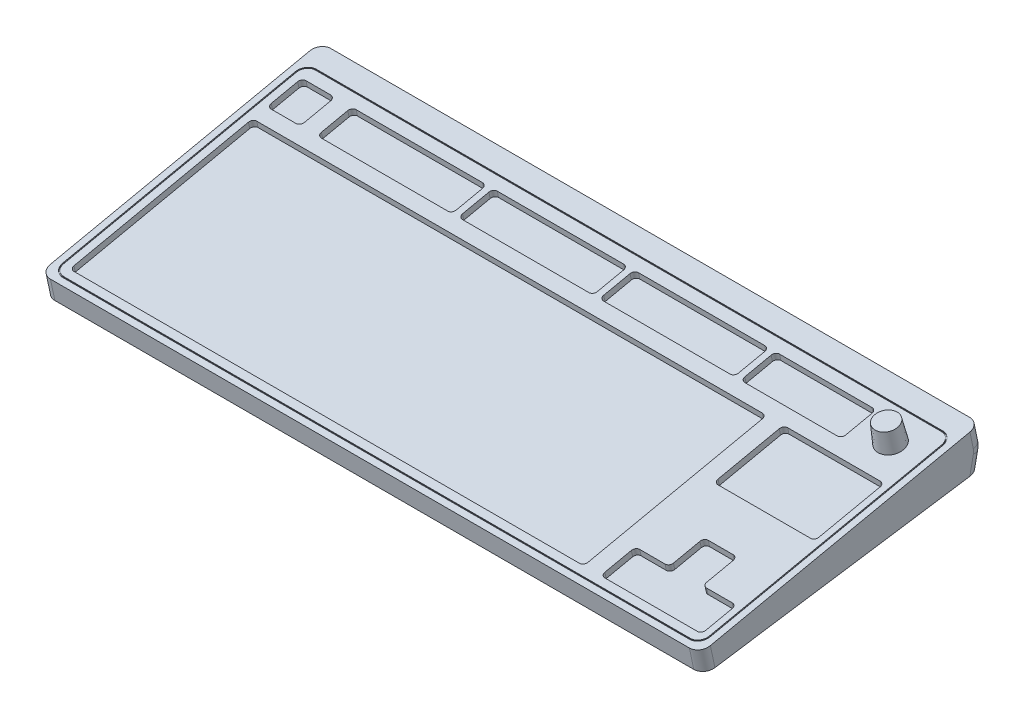
from build123d import *

# Parameters (mm, degrees)
SKETCH2_W               = 311
SKETCH2_H               = 135
BOSS_EXTRUDE1_DEPTH     = 10
BOSS_EXTRUDE2_DEPTH     = 311
FILLET1_R               = 10
FILLET2_R               = 5
CUT_EXTRUDE_THIN1_DEPTH = 0.5
CUT_EXTRUDE1_DEPTH      = 3
SKETCH8_R               = 6
BOSS_EXTRUDE3_DEPTH     = 10
BOSS_EXTRUDE3_TAPER     = 4


with BuildPart() as part:
    # Sketch2 → Boss-Extrude1 (new body)
    with BuildSketch(Plane(origin=(0, 0, 0), x_dir=(1, 0, 0), z_dir=(0, 0.9781476007338056, 0.2079116908177598))):
        with Locations((155.5, 67.5)):
            Rectangle(SKETCH2_W, SKETCH2_H)
    extrude(amount=-BOSS_EXTRUDE1_DEPTH)

    # Sketch5 → Boss-Extrude2 (add)
    with BuildSketch(Plane.ZY):
        Polygon((-134.129043007, 18.286602253), (-132.399185443, 9.762104074), (-2.079116908, -9.781476007), align=None)
    extrude(amount=-BOSS_EXTRUDE2_DEPTH)

    # Fillet1
    fillet1_edges = [part.edges().sort_by_distance(p)[0] for p in [
        (155.5, 18.286602253, -134.129043007),
    ]]
    fillet(fillet1_edges, radius=FILLET1_R)

    # Fillet2
    fillet2_edges = [part.edges().sort_by_distance(p)[0] for p in [
        (311, 24.193330233, -132.873529217),
        (0, 24.193330233, -132.873529217),
        (0, 13.006413151, -133.057545909),
        (0, 18.285616937, -133.915549829),
        (311, 13.006413151, -133.057545909),
        (311, 18.285616937, -133.915549829),
        (311, -4.890738004, -1.039558454),
        (0, -4.890738004, -1.039558454),
    ]]
    fillet(fillet2_edges, radius=FILLET2_R)

    # Sketch6 → Cut-Extrude-Thin1 (cut)
    # profile 1 of 2: a face of its own
    with BuildSketch(Plane(origin=(0, 0, 0), x_dir=(1, 0, 0), z_dir=(0, 0.9781476007338056, 0.20791169081775976))):
        with BuildLine():
            Line((3, 120), (3, 8))
            ThreePointArc((3, 8), (4.464466094, 4.464466094), (8, 3))
            Line((8, 3), (303, 3))
            ThreePointArc((303, 3), (306.535533906, 4.464466094), (308, 8))
            Line((308, 8), (308, 120))
            ThreePointArc((308, 120), (306.535533906, 123.535533906), (303, 125))
            Line((303, 125), (8, 125))
            ThreePointArc((8, 125), (4.464466094, 123.535533906), (3, 120))
        make_face()
        with BuildLine():
            Line((3.5, 120), (3.5, 8))
            ThreePointArc((3.5, 8), (4.818019485, 4.818019485), (8, 3.5))
            Line((8, 3.5), (303, 3.5))
            ThreePointArc((303, 3.5), (306.181980515, 4.818019485), (307.5, 8))
            Line((307.5, 8), (307.5, 120))
            ThreePointArc((307.5, 120), (306.181980515, 123.181980515), (303, 124.5))
            Line((303, 124.5), (8, 124.5))
            ThreePointArc((8, 124.5), (4.818019485, 123.181980515), (3.5, 120))
        make_face(mode=Mode.SUBTRACT)
    # profile 2 of 2: a face of its own
    with BuildSketch(Plane(origin=(0, 0, 0), x_dir=(1, 0, 0), z_dir=(0, 0.9781476007338056, 0.20791169081775976))):
        with BuildLine():
            ThreePointArc((15, 10), (11.464466094, 11.464466094), (10, 15))
            Line((10, 15), (9.5, 15))
            ThreePointArc((9.5, 15), (11.110912703, 11.110912703), (15, 9.5))
            Line((15, 9.5), (15, 10))
        make_face()
    extrude(amount=-CUT_EXTRUDE_THIN1_DEPTH, mode=Mode.SUBTRACT)

    # Sketch7 → Cut-Extrude1 (cut)
    with BuildSketch(Plane(origin=(0, 0, 0), x_dir=(1, 0, 0), z_dir=(0, 0.9781476007338056, 0.20791169081775976))):
        with BuildLine():
            Line((9, 119), (20.6, 119))
            ThreePointArc((20.6, 119), (22.014213562, 118.414213562), (22.6, 117))
            Line((22.6, 117), (22.6, 104.3))
            ThreePointArc((22.6, 104.3), (22.014213562, 102.885786438), (20.6, 102.3))
            Line((20.6, 102.3), (9, 102.3))
            ThreePointArc((9, 102.3), (7.585786438, 102.885786438), (7, 104.3))
            Line((7, 104.3), (7, 117))
            ThreePointArc((7, 117), (7.585786438, 118.414213562), (9, 119))
        make_face()
        with BuildLine():
            Line((302.6, 24.05), (290.675, 24.05))
            ThreePointArc((290.675, 24.05), (289.260786438, 24.635786438), (288.675, 26.05))
            Line((288.675, 26.05), (288.675, 38.8))
            ThreePointArc((288.675, 38.8), (288.089213562, 40.214213562), (286.675, 40.8))
            Line((286.675, 40.8), (275.025, 40.8))
            ThreePointArc((275.025, 40.8), (273.610786438, 40.214213562), (273.025, 38.8))
            Line((273.025, 38.8), (273.025, 26.05))
            ThreePointArc((273.025, 26.05), (272.439213562, 24.635786438), (271.025, 24.05))
            Line((271.025, 24.05), (259.1, 24.05))
            ThreePointArc((259.1, 24.05), (257.685786438, 23.464213562), (257.1, 22.05))
            Line((257.1, 22.05), (257.1, 9.3))
            ThreePointArc((257.1, 9.3), (257.685786438, 7.885786438), (259.1, 7.3))
            Line((259.1, 7.3), (302.6, 7.3))
            ThreePointArc((302.6, 7.3), (304.014213562, 7.885786438), (304.6, 9.3))
            Line((304.6, 9.3), (304.6, 22.05))
            ThreePointArc((304.6, 22.05), (304.014213562, 23.464213562), (302.6, 24.05))
        make_face()
        with BuildLine():
            Line((32.6, 119), (92.1, 119))
            ThreePointArc((92.1, 119), (93.514213562, 118.414213562), (94.1, 117))
            Line((94.1, 117), (94.1, 104.3))
            ThreePointArc((94.1, 104.3), (93.514213562, 102.885786438), (92.1, 102.3))
            Line((92.1, 102.3), (32.6, 102.3))
            ThreePointArc((32.6, 102.3), (31.185786438, 102.885786438), (30.6, 104.3))
            Line((30.6, 104.3), (30.6, 117))
            ThreePointArc((30.6, 117), (31.185786438, 118.414213562), (32.6, 119))
        make_face()
        with BuildLine():
            Line((99.1, 119), (158.6, 119))
            ThreePointArc((158.6, 119), (160.014213562, 118.414213562), (160.6, 117))
            Line((160.6, 117), (160.6, 104.3))
            ThreePointArc((160.6, 104.3), (160.014213562, 102.885786438), (158.6, 102.3))
            Line((158.6, 102.3), (99.1, 102.3))
            ThreePointArc((99.1, 102.3), (97.685786438, 102.885786438), (97.1, 104.3))
            Line((97.1, 104.3), (97.1, 117))
            ThreePointArc((97.1, 117), (97.685786438, 118.414213562), (99.1, 119))
        make_face()
        with BuildLine():
            Line((165.6, 119), (225.1, 119))
            ThreePointArc((225.1, 119), (226.514213562, 118.414213562), (227.1, 117))
            Line((227.1, 117), (227.1, 104.3))
            ThreePointArc((227.1, 104.3), (226.514213562, 102.885786438), (225.1, 102.3))
            Line((225.1, 102.3), (165.6, 102.3))
            ThreePointArc((165.6, 102.3), (164.185786438, 102.885786438), (163.6, 104.3))
            Line((163.6, 104.3), (163.6, 117))
            ThreePointArc((163.6, 117), (164.185786438, 118.414213562), (165.6, 119))
        make_face()
        with BuildLine():
            Line((232.1, 119), (275.6, 119))
            ThreePointArc((275.6, 119), (277.014213562, 118.414213562), (277.6, 117))
            Line((277.6, 117), (277.6, 104.3))
            ThreePointArc((277.6, 104.3), (277.014213562, 102.885786438), (275.6, 102.3))
            Line((275.6, 102.3), (232.1, 102.3))
            ThreePointArc((232.1, 102.3), (230.685786438, 102.885786438), (230.1, 104.3))
            Line((230.1, 104.3), (230.1, 117))
            ThreePointArc((230.1, 117), (230.685786438, 118.414213562), (232.1, 119))
        make_face()
        with BuildLine():
            Line((9, 95.3), (247.1, 95.3))
            ThreePointArc((247.1, 95.3), (248.514213562, 94.714213562), (249.1, 93.3))
            Line((249.1, 93.3), (249.1, 9.3))
            ThreePointArc((249.1, 9.3), (248.514213562, 7.885786438), (247.1, 7.3))
            Line((247.1, 7.3), (9, 7.3))
            ThreePointArc((9, 7.3), (7.585786438, 7.885786438), (7, 9.3))
            Line((7, 9.3), (7, 93.3))
            ThreePointArc((7, 93.3), (7.585786438, 94.714213562), (9, 95.3))
        make_face()
        with BuildLine():
            Line((259.1, 95.3), (302.6, 95.3))
            ThreePointArc((302.6, 95.3), (304.014213562, 94.714213562), (304.6, 93.3))
            Line((304.6, 93.3), (304.6, 63.8))
            ThreePointArc((304.6, 63.8), (304.014213562, 62.385786438), (302.6, 61.8))
            Line((302.6, 61.8), (259.1, 61.8))
            ThreePointArc((259.1, 61.8), (257.685786438, 62.385786438), (257.1, 63.8))
            Line((257.1, 63.8), (257.1, 93.3))
            ThreePointArc((257.1, 93.3), (257.685786438, 94.714213562), (259.1, 95.3))
        make_face()
    extrude(amount=-CUT_EXTRUDE1_DEPTH, mode=Mode.SUBTRACT)

    # Sketch8 → Boss-Extrude3 (add)
    with BuildSketch(Plane(origin=(0, 0, 0), x_dir=(1, 0, 0), z_dir=(0, 0.9781476007338055, 0.20791169081775973))):
        with Locations((292.55, 110.65)):
            Circle(SKETCH8_R)
    extrude(amount=BOSS_EXTRUDE3_DEPTH, taper=BOSS_EXTRUDE3_TAPER)


solid = part.part
